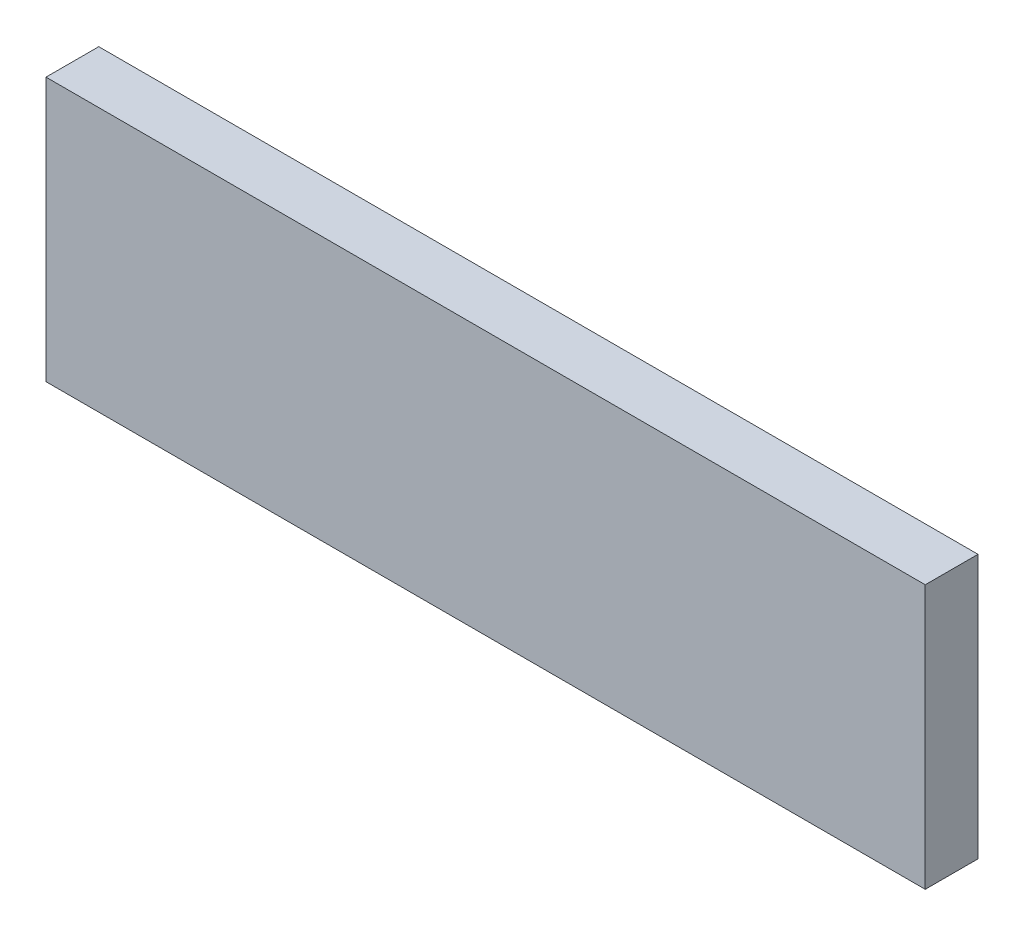
from build123d import *

# Parameters (mm, degrees)
SKETCH1_W           = 50
SKETCH1_H           = 15
BOSS_EXTRUDE1_DEPTH = 3


with BuildPart() as part:
    # Sketch1 → Boss-Extrude1 (new body)
    with BuildSketch(Plane.XY):
        with Locations((25, 7.5)):
            Rectangle(SKETCH1_W, SKETCH1_H)
    extrude(amount=BOSS_EXTRUDE1_DEPTH)


solid = part.part
